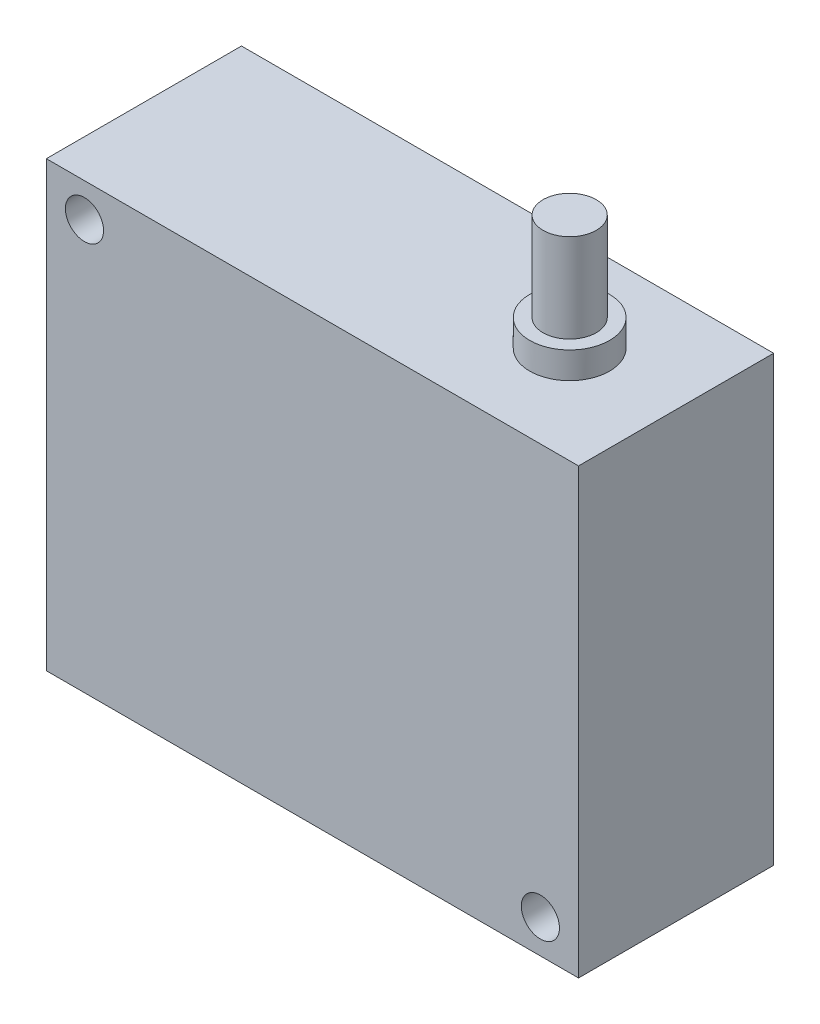
from build123d import *

# Parameters (mm, degrees)
SKETCH_1_W          = 60
SKETCH_1_H          = 50
EXTRUDE_1_DEPTH     = 22
SKETCH_2_R          = 4.5
EXTRUDE_2_DEPTH     = 3
SKETCH_3_R          = 3
EXTRUDE_3_DEPTH     = 10
SKETCH_4_R          = 0.5
EXTRUDE_4_DEPTH     = 5
SKETCH_5_W          = 40
SKETCH_5_H          = 10
CUT_EXTRUDE_1_DEPTH = 0.01
SKETCH_6_R          = 2.15
CUT_EXTRUDE_2_DEPTH = 90.738509014
CUT_EXTRUDE_3_DEPTH = 90.738509014


with BuildPart() as part:
    # 草图1 → 凸台-拉伸1 (new body)
    with BuildSketch(Plane.XY):
        with Locations((30, 25)):
            Rectangle(SKETCH_1_W, SKETCH_1_H)
    extrude(amount=EXTRUDE_1_DEPTH)

    # 草图2 → 凸台-拉伸2 (add)
    with BuildSketch(Plane(origin=(0, 50, 0), x_dir=(1, 0, 0), z_dir=(0, 1, 0))):
        with Locations(Location((48, -11, 0), (0, 0, 90))):
            Circle(SKETCH_2_R)
    extrude(amount=EXTRUDE_2_DEPTH)

    # 草图3 → 凸台-拉伸3 (add)
    with BuildSketch(Plane(origin=(0, 53, 0), x_dir=(1, 0, 0), z_dir=(0, 1, 0))):
        with Locations(Location((48, -11, 0), (0, 0, 270))):
            Circle(SKETCH_3_R)
    extrude(amount=EXTRUDE_3_DEPTH)

    # 草图4 → 凸台-拉伸4 (add)
    with BuildSketch(Plane.XZ):
        with Locations(Location((12.5, 7.5, 0), (0, 0, 90))):
            Circle(SKETCH_4_R)
    extrude(amount=EXTRUDE_4_DEPTH)

    # 草图5 → 切除-拉伸1 (cut)
    with BuildSketch(Plane.XZ):
        with Locations((25, 7.5)):
            Rectangle(SKETCH_5_W, SKETCH_5_H)
    extrude(amount=-CUT_EXTRUDE_1_DEPTH, mode=Mode.SUBTRACT)


with BuildPart() as cut_extrude_1_piece_1:
    # of the separate pieces the step leaves, piece 1, a body of its own (cut_extrude_1_pieces)
    add(part.part.solids().sort_by_distance((0, 0, 0))[0])

    # 草图6 → 切除-拉伸2 (cut, through all)
    with BuildSketch(Plane.XY.offset(22)):
        with Locations((55.7, 3.8)):
            Circle(SKETCH_6_R)
        with Locations((4.3, 46.2)):
            Circle(SKETCH_6_R)
    extrude(amount=-CUT_EXTRUDE_2_DEPTH, mode=Mode.SUBTRACT)


with BuildPart() as cut_extrude_1_piece_2:
    # of the separate pieces the step leaves, piece 2, a body of its own (cut_extrude_1_pieces)
    add(part.part.solids().sort_by_distance((12.5, 0, 8))[0])

    # 草图7 → 切除-拉伸3 (cut, through all)
    with BuildSketch(Plane(origin=(60, 0, 0), x_dir=(0, 0, -1), z_dir=(1, 0, 0))):
        Polygon((-7.5, -5), (-8, -4.5), (-8, -5), align=None)
    extrude(amount=-CUT_EXTRUDE_3_DEPTH, mode=Mode.SUBTRACT)


solid = Compound([cut_extrude_1_piece_1.part, cut_extrude_1_piece_2.part])
